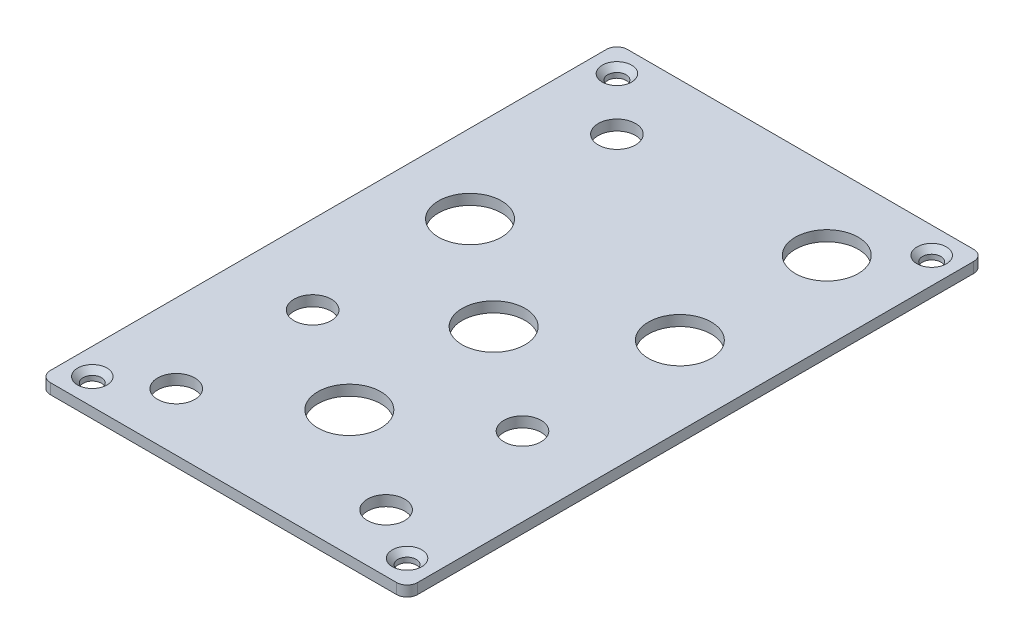
from build123d import *

# Parameters (mm, degrees)
FACE_PLATE_W           = 70
FACE_PLATE_H           = 110
FACE_PLATE_EXT_DEPTH   = 2
BUTTONS_R              = 6
BUTTONS_R_2            = 3.55
BUTTONS_CUT_DEPTH      = 10
M3_TOP_SCREW_R         = 1.75
M3_TOP_SCREW_CUT_DEPTH = 10
FILLET1_R              = 2
FILLET2_R              = 2
FILLET3_R              = 2
FILLET4_R              = 2


with BuildPart() as part:
    # Face Plate → Face Plate Ext (new body)
    with BuildSketch(Plane(origin=(0, 0, 0), x_dir=(1, 0, 0), z_dir=(0, 1, 0))):
        Rectangle(FACE_PLATE_W, FACE_PLATE_H)
    extrude(amount=FACE_PLATE_EXT_DEPTH)

    # Buttons → Buttons CUT (cut)
    with BuildSketch(Plane(origin=(0, 2, 0), x_dir=(1, 0, 0), z_dir=(0, 1, 0))):
        with Locations(Location((-20, 12, 0), (0, 0, 270))):
            Circle(BUTTONS_R)
        with Locations(Location((20, 12, 0), (0, 0, 270))):
            Circle(BUTTONS_R)
        with Locations(Location((-20, -18, 0), (0, 0, 270))):
            Circle(BUTTONS_R_2)
        with Locations(Location((-20, -44, 0), (0, 0, 270))):
            Circle(BUTTONS_R_2)
        with Locations(Location((-20, 40, 0), (0, 0, 270))):
            Circle(BUTTONS_R_2)
        with Locations(Location((20, -18, 0), (0, 0, 270))):
            Circle(BUTTONS_R_2)
        with Locations(Location((20, -44, 0), (0, 0, 270))):
            Circle(BUTTONS_R_2)
        with Locations(Location((20, 40, 0), (0, 0, 270))):
            Circle(BUTTONS_R)
        with Locations(Location((0, -31, 0), (0, 0, 270))):
            Circle(BUTTONS_R)
        with Locations(Location((0, -3.5, 0), (0, 0, 270))):
            Circle(BUTTONS_R)
    extrude(amount=-BUTTONS_CUT_DEPTH, mode=Mode.SUBTRACT)

    # M3 Top Screw → M3 Top Screw CUT (cut)
    with BuildSketch(Plane(origin=(0, 2, 0), x_dir=(1, 0, 0), z_dir=(0, 1, 0))):
        with Locations(Location((-30, 50, 0), (0, 0, 270))):
            Circle(M3_TOP_SCREW_R)
        with Locations(Location((30, 50, 0), (0, 0, 270))):
            Circle(M3_TOP_SCREW_R)
        with Locations(Location((-30, -50, 0), (0, 0, 270))):
            Circle(M3_TOP_SCREW_R)
        with Locations(Location((30, -50, 0), (0, 0, 270))):
            Circle(M3_TOP_SCREW_R)
    extrude(amount=-M3_TOP_SCREW_CUT_DEPTH, mode=Mode.SUBTRACT)

    # M3 Head Top CUT cone 1 section (through the dimple's axis) → M3 Head Top CUT (revolve, cut)
    with BuildSketch(Plane(origin=(-30, 2, -50), x_dir=(0, 0, 1), z_dir=(1, 0, 0))):
        Polygon((0, 0), (2.8, 0), (0, 2.8), align=None)
    revolve(axis=Axis((-30, 2, -50), (0, -1, 0)), mode=Mode.SUBTRACT)

    # M3 Head Top CUT cone 2 section (through the dimple's axis) → M3 Head Top CUT cone 2 (revolve, cut)
    with BuildSketch(Plane(origin=(30, 2, -50), x_dir=(0, 0, 1), z_dir=(1, 0, 0))):
        Polygon((0, 0), (2.8, 0), (0, 2.8), align=None)
    revolve(axis=Axis((30, 2, -50), (0, -1, 0)), mode=Mode.SUBTRACT)

    # M3 Head Top CUT cone 3 section (through the dimple's axis) → M3 Head Top CUT cone 3 (revolve, cut)
    with BuildSketch(Plane(origin=(30, 2, 50), x_dir=(0, 0, 1), z_dir=(1, 0, 0))):
        Polygon((0, 0), (2.8, 0), (0, 2.8), align=None)
    revolve(axis=Axis((30, 2, 50), (0, -1, 0)), mode=Mode.SUBTRACT)

    # M3 Head Top CUT cone 4 section (through the dimple's axis) → M3 Head Top CUT cone 4 (revolve, cut)
    with BuildSketch(Plane(origin=(-30, 2, 50), x_dir=(0, 0, 1), z_dir=(1, 0, 0))):
        Polygon((0, 0), (2.8, 0), (0, 2.8), align=None)
    revolve(axis=Axis((-30, 2, 50), (0, -1, 0)), mode=Mode.SUBTRACT)

    # Fillet1
    fillet1_edges = [part.edges().sort_by_distance(p)[0] for p in [
        (-35, 1, -55),
    ]]
    fillet(fillet1_edges, radius=FILLET1_R)

    # Fillet2
    fillet2_edges = [part.edges().sort_by_distance(p)[0] for p in [
        (35, 1, -55),
    ]]
    fillet(fillet2_edges, radius=FILLET2_R)

    # Fillet3
    fillet3_edges = [part.edges().sort_by_distance(p)[0] for p in [
        (35, 1, 55),
    ]]
    fillet(fillet3_edges, radius=FILLET3_R)

    # Fillet4
    fillet4_edges = [part.edges().sort_by_distance(p)[0] for p in [
        (-35, 1, 55),
    ]]
    fillet(fillet4_edges, radius=FILLET4_R)


solid = part.part
